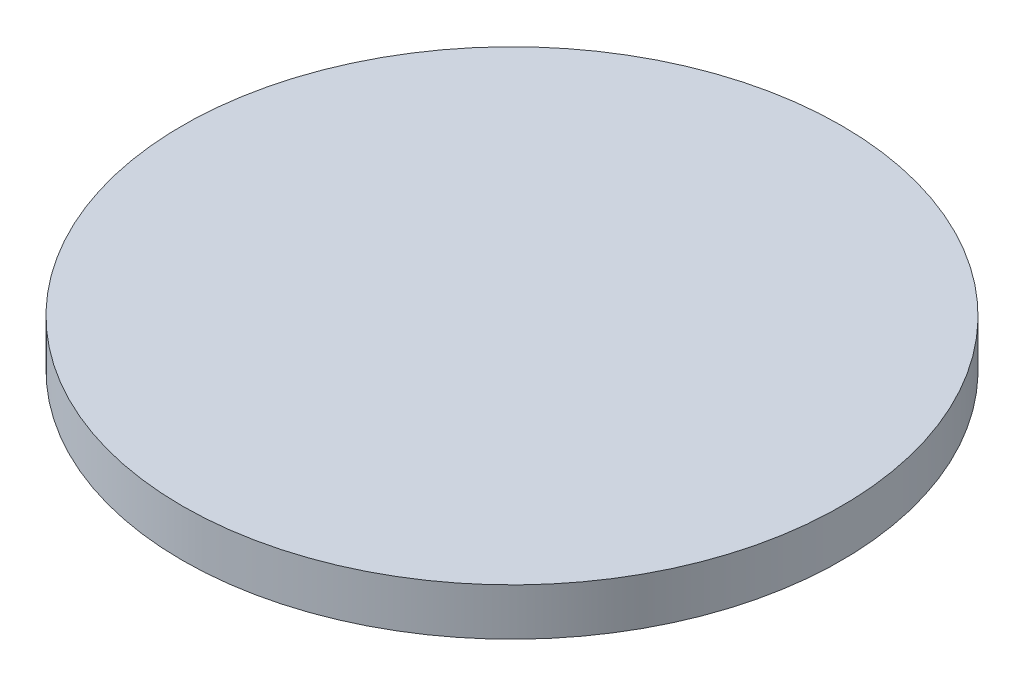
from build123d import *

# Parameters (mm, degrees)
SKETCH1_R           = 70
BOSS_EXTRUDE1_DEPTH = 10


with BuildPart() as part:
    # Sketch1 → Boss-Extrude1 (new body)
    with BuildSketch(Plane(origin=(0, 0, 0), x_dir=(1, 0, 0), z_dir=(0, 1, 0))):
        with Locations(Location((0, 0, 0), (0, 0, 270))):
            Circle(SKETCH1_R)
    extrude(amount=BOSS_EXTRUDE1_DEPTH)


solid = part.part
